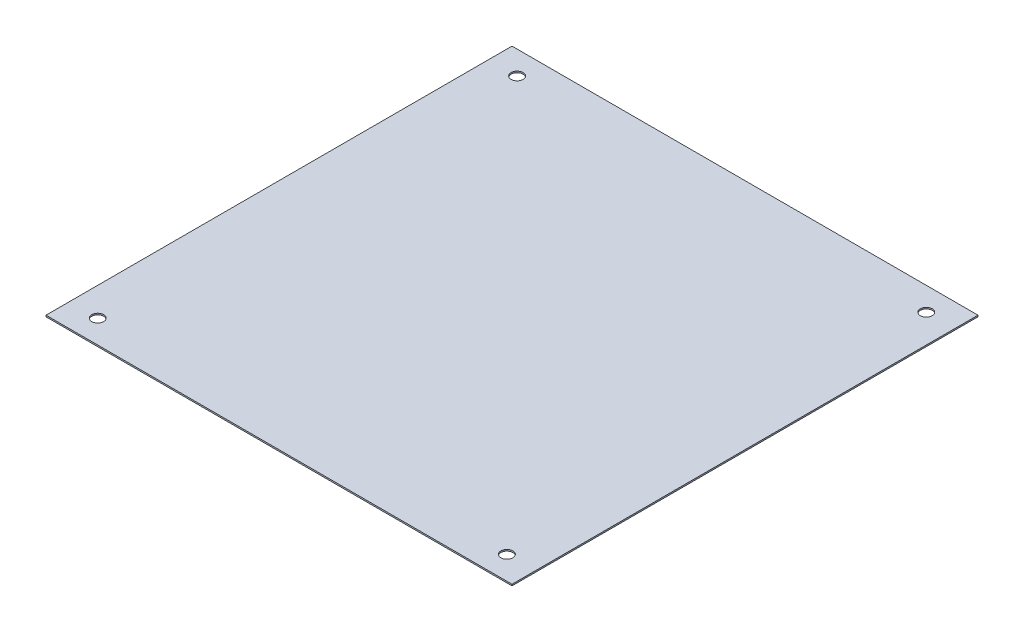
from build123d import *

# Parameters (mm, degrees)
SKETCH1_W           = 254
SKETCH1_H           = 254
SKETCH1_R           = 3.2639
BOSS_EXTRUDE1_DEPTH = 0.79375


with BuildPart() as part:
    # Sketch1 → Boss-Extrude1 (new body)
    with BuildSketch(Plane(origin=(0, 0, 0), x_dir=(1, 0, 0), z_dir=(0, 1, 0))):
        with Locations((127, 127)):
            Rectangle(SKETCH1_W, SKETCH1_H)
        with Locations(Location((15.494, 241.3, 0), (0, 0, 270))):
            Circle(SKETCH1_R, mode=Mode.SUBTRACT)
        with Locations(Location((238.506, 241.3, 0), (0, 0, 270))):
            Circle(SKETCH1_R, mode=Mode.SUBTRACT)
        with Locations(Location((238.506, 12.7, 0), (0, 0, 270))):
            Circle(SKETCH1_R, mode=Mode.SUBTRACT)
        with Locations(Location((15.494, 12.7, 0), (0, 0, 270))):
            Circle(SKETCH1_R, mode=Mode.SUBTRACT)
    extrude(amount=BOSS_EXTRUDE1_DEPTH)


solid = part.part
